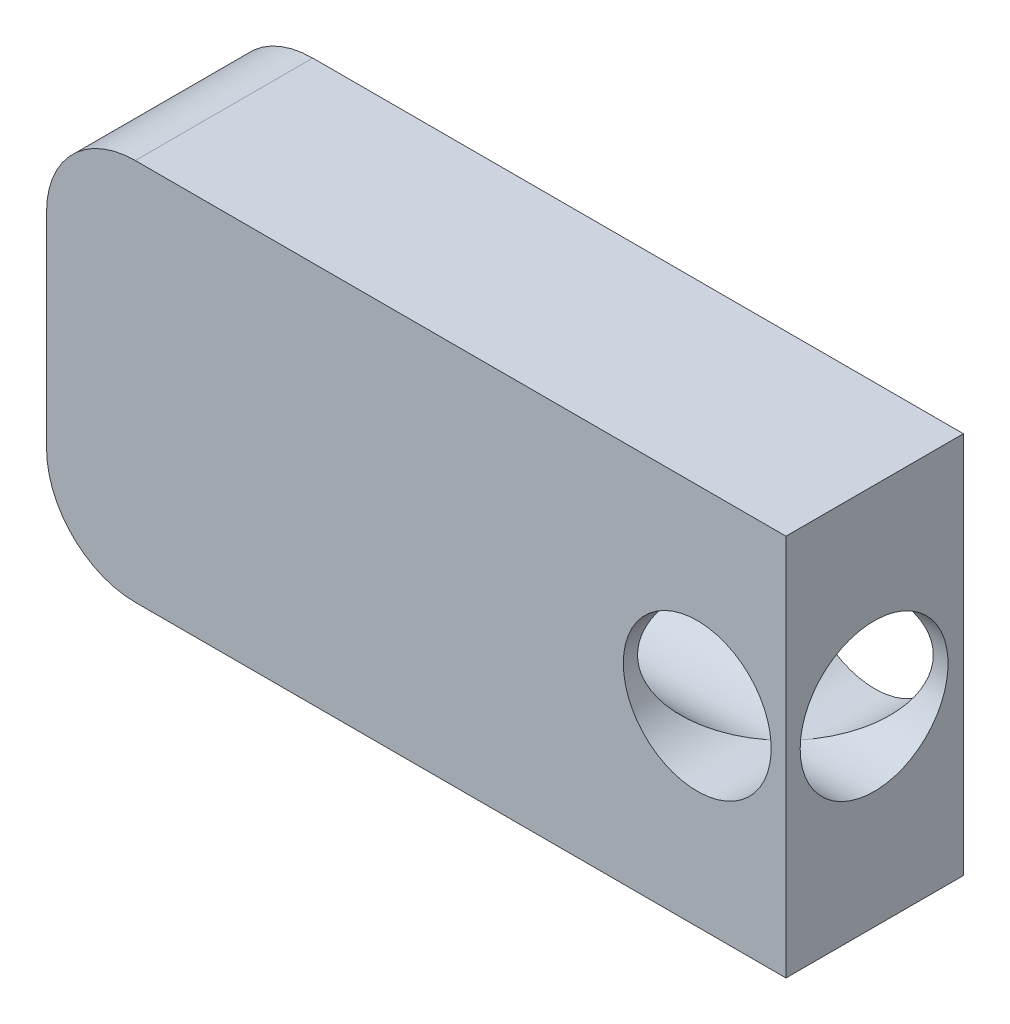
from build123d import *

# Parameters (mm, degrees)
SKETCH4_R           = 2.5
BOSS_EXTRUDE2_DEPTH = 6
SKETCH5_R           = 2.5
CUT_EXTRUDE1_DEPTH  = 27.511142593


with BuildPart() as part:
    # Sketch4 → Boss-Extrude2 (new body)
    with BuildSketch(Plane.XY):
        with BuildLine():
            Line((-9.5, 6.468437336), (12.5, 6.468437336))
            Line((12.5, 6.468437336), (12.5, -6.468437336))
            Line((12.5, -6.468437336), (-9.5, -6.468437336))
            ThreePointArc((-9.5, -6.468437336), (-11.621320344, -5.58975768), (-12.5, -3.468437336))
            Line((-12.5, -3.468437336), (-12.5, 3.468437336))
            ThreePointArc((-12.5, 3.468437336), (-11.621320344, 5.58975768), (-9.5, 6.468437336))
        make_face()
        with Locations(Location((9.5, 0, 0), (0, 0, 180))):
            Circle(SKETCH4_R, mode=Mode.SUBTRACT)
    extrude(amount=BOSS_EXTRUDE2_DEPTH)

    # Sketch5 → Cut-Extrude1 (cut, through all)
    with BuildSketch(Plane.ZY.offset(12.5)):
        with Locations((3.019651732, 0)):
            Circle(SKETCH5_R)
    extrude(amount=-CUT_EXTRUDE1_DEPTH, mode=Mode.SUBTRACT)


solid = part.part
